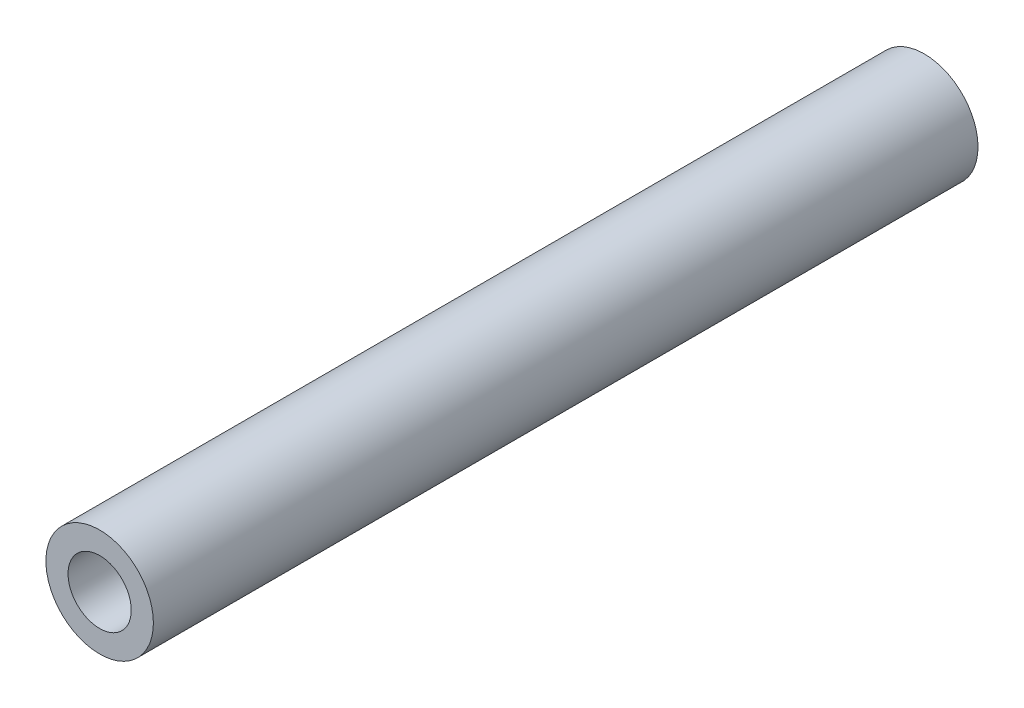
from build123d import *

# Parameters (mm, degrees)
SKETCH1_R           = 3.91
SKETCH1_R_2         = 2.3
BOSS_EXTRUDE1_DEPTH = 60


with BuildPart() as part:
    # Sketch1 → Boss-Extrude1 (new body)
    with BuildSketch(Plane.XY):
        Circle(SKETCH1_R)
        Circle(SKETCH1_R_2, mode=Mode.SUBTRACT)
    extrude(amount=BOSS_EXTRUDE1_DEPTH)


solid = part.part
